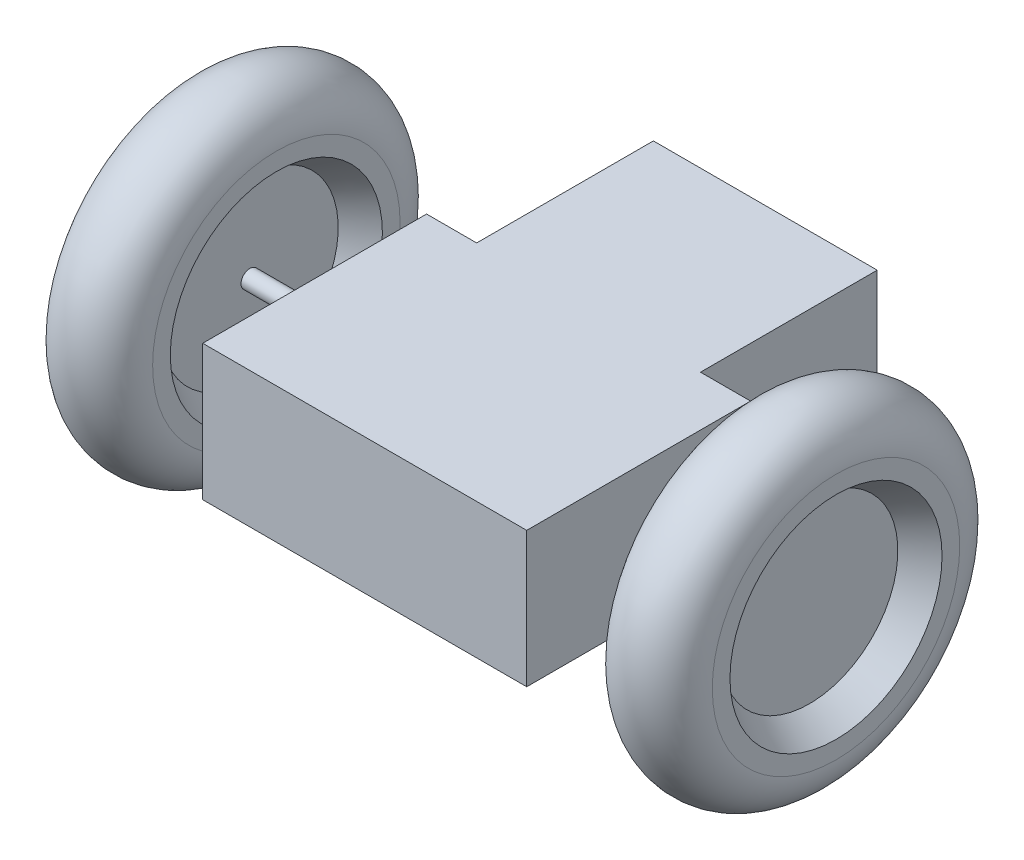
from build123d import *

# Parameters (mm, degrees)
BOSS_EXTRUDE1_DEPTH      = 11.5
BOSS_EXTRUDE1_DEPTH_BACK = 11.5
SKETCH1_W                = 55
SKETCH1_H                = 68
SKETCH2_R                = 1.5
BOSS_EXTRUDE2_DEPTH      = 12.5
SKETCH7_W                = 8.5
SKETCH7_H                = 30
CUT_EXTRUDE1_DEPTH       = 78.661122935
SKETCH8_W                = 5
SKETCH8_H                = 8
SKETCH8_R                = 1.5
BOSS_EXTRUDE3_DEPTH      = 2


with BuildPart() as part:
    # Sketch1 → Boss-Extrude1 (new, two sides: drawn at the far end of the back side and taken through both)
    with BuildSketch(Plane(origin=(0, 0, 0), x_dir=(1, 0, 0), z_dir=(0, 1, 0)).offset(-BOSS_EXTRUDE1_DEPTH_BACK)):
        Rectangle(SKETCH1_W, SKETCH1_H)
    extrude(amount=BOSS_EXTRUDE1_DEPTH + BOSS_EXTRUDE1_DEPTH_BACK)

    # Sketch2 → Boss-Extrude2 (add)
    with BuildSketch(Plane(origin=(27.5, 0, 0), x_dir=(0, 0, -1), z_dir=(1, 0, 0))):
        with Locations((-9, 0)):
            Circle(SKETCH2_R)
    boss_extrude2 = extrude(amount=BOSS_EXTRUDE2_DEPTH)

    # Sketch6 → Revolve1 (revolve)
    with BuildSketch(Plane(origin=(0, 0, 0), x_dir=(1, 0, 0), z_dir=(0, 1, 0))):
        with BuildLine():
            Line((40, -7.5), (44.5, -7.5))
            Line((44.5, -7.5), (44.5, 6))
            Line((44.5, 6), (40, 9))
            Line((40, 9), (40, 12))
            ThreePointArc((40, 12), (47.5, 19.5), (55, 12))
            Line((55, 12), (55, 9))
            Line((55, 9), (50.5, 6))
            Line((50.5, 6), (50.5, -9))
            Line((50.5, -9), (40, -9))
            Line((40, -9), (40, -7.5))
        make_face()
    revolve1 = revolve(axis=Axis((42.5, 0, 9), (1, 0, 0)))

    # Mirror1: Boss-Extrude2, Revolve1 across plane
    add(boss_extrude2.mirror(Plane(origin=(0, 0, 0), x_dir=(0, 0, 1), z_dir=(1, 0, 0))))
    add(revolve1.mirror(Plane(origin=(0, 0, 0), x_dir=(0, 0, 1), z_dir=(1, 0, 0))))

    # Sketch7 → Cut-Extrude1 (cut, through all)
    with BuildSketch(Plane(origin=(0, 11.5, 0), x_dir=(1, 0, 0), z_dir=(0, 1, 0))):
        with Locations((-23.25, 19)):
            Rectangle(SKETCH7_W, SKETCH7_H)
        with Locations((23.25, 19)):
            Rectangle(SKETCH7_W, SKETCH7_H)
    extrude(amount=-CUT_EXTRUDE1_DEPTH, mode=Mode.SUBTRACT)

    # Sketch8 → Boss-Extrude3 (add)
    # profile 1 of 2: a face of its own
    with BuildSketch(Plane.XZ.offset(11.5)):
        with Locations((-30, 15)):
            Rectangle(SKETCH8_W, SKETCH8_H)
        with Locations((-30, 15)):
            Circle(SKETCH8_R, mode=Mode.SUBTRACT)
    # profile 2 of 2: a face of its own
    with BuildSketch(Plane.XZ.offset(11.5)):
        with Locations((30, 15)):
            Rectangle(SKETCH8_W, SKETCH8_H)
        with Locations((30, 15)):
            Circle(SKETCH8_R, mode=Mode.SUBTRACT)
    extrude(amount=-BOSS_EXTRUDE3_DEPTH)


solid = part.part
